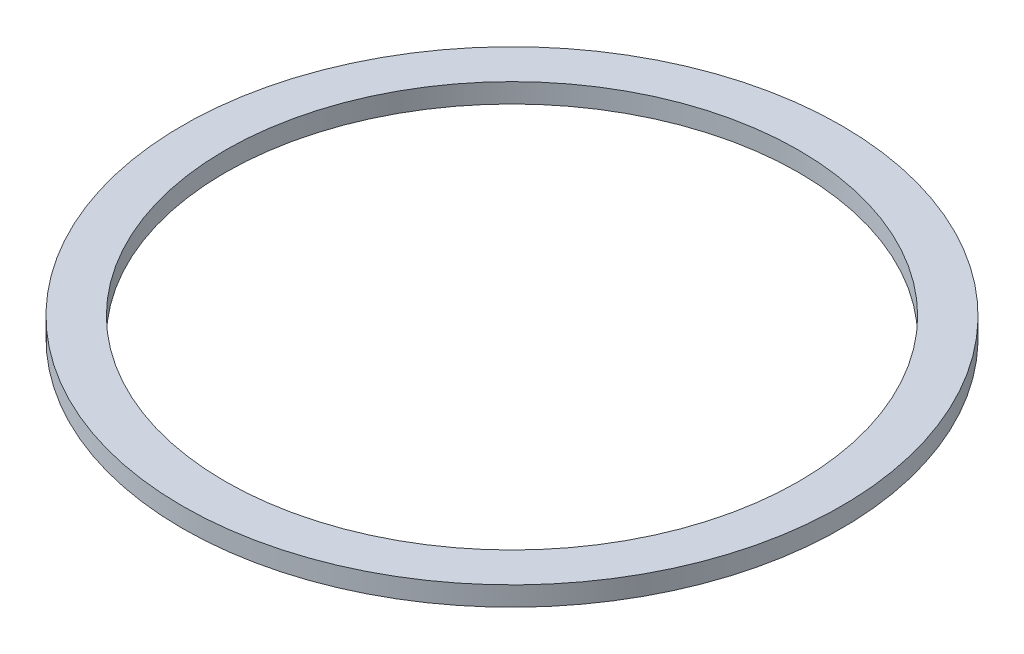
from build123d import *

# Parameters (mm, degrees)
SKETCH1_R           = 27
SKETCH1_R_2         = 23.5
BOSS_EXTRUDE1_DEPTH = 1.5875


with BuildPart() as part:
    # Sketch1 → Boss-Extrude1 (new body)
    with BuildSketch(Plane(origin=(0, 0, 0), x_dir=(1, 0, 0), z_dir=(0, 1, 0))):
        with Locations(Location((0, 0, 0), (0, 0, 270))):
            Circle(SKETCH1_R)
        with Locations(Location((0, 0, 0), (0, 0, 270))):
            Circle(SKETCH1_R_2, mode=Mode.SUBTRACT)
    extrude(amount=BOSS_EXTRUDE1_DEPTH)


solid = part.part
